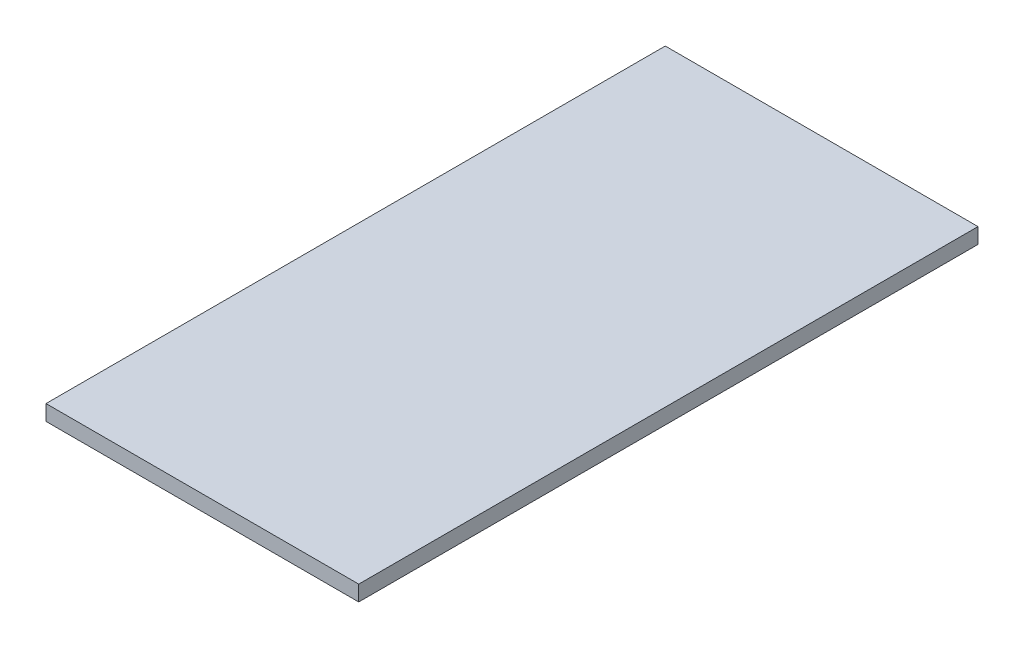
from build123d import *

# Parameters (mm, degrees)
SKETCH_1_W      = 101
SKETCH_1_H      = 200
EXTRUDE_1_DEPTH = 5


with BuildPart() as part:
    # 스케치1 → 보스-돌출1 (new body)
    with BuildSketch(Plane(origin=(0, 0, 0), x_dir=(1, 0, 0), z_dir=(0, 1, 0))):
        Rectangle(SKETCH_1_W, SKETCH_1_H)
    extrude(amount=EXTRUDE_1_DEPTH)


solid = part.part
